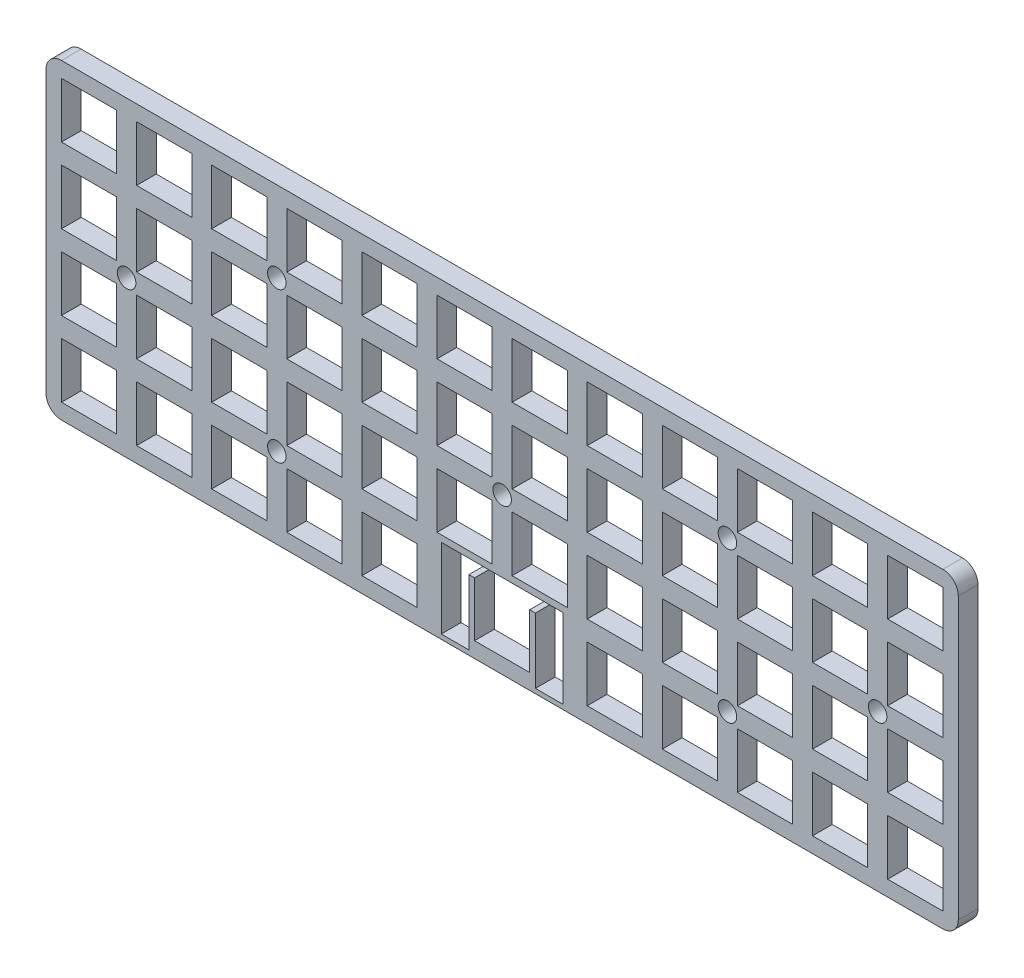
from build123d import *

# Parameters (mm, degrees)
CROQUIS3_W         = 14
CROQUIS3_H         = 14
CROQUIS3_R         = 2.35
MAINPLATE_DEPTH    = 5
F_5MM_CUTOUT_DEPTH = 255.927423495


with BuildPart() as part:
    # Croquis3 → MainPlate (new body)
    with BuildSketch(Plane.XY):
        with BuildLine():
            ThreePointArc((235.6, 8.125), (238.375394116, 9.274605884), (239.525, 12.05))
            Line((239.525, 12.05), (239.525, 83.2))
            ThreePointArc((239.525, 83.2), (238.375394116, 85.975394116), (235.6, 87.125))
            Line((235.6, 87.125), (12.05, 87.125))
            ThreePointArc((12.05, 87.125), (9.274605884, 85.975394116), (8.125, 83.2))
            Line((8.125, 83.2), (8.125, 12.05))
            ThreePointArc((8.125, 12.05), (9.274605884, 9.274605884), (12.05, 8.125))
            Line((12.05, 8.125), (235.6, 8.125))
        make_face()
        with Locations((123.825, 19.05)):
            Rectangle(CROQUIS3_W, CROQUIS3_H, mode=Mode.SUBTRACT)
        with Locations((19.05, 19.05)):
            Rectangle(CROQUIS3_W, CROQUIS3_H, mode=Mode.SUBTRACT)
        with Locations((38.1, 19.05)):
            Rectangle(CROQUIS3_W, CROQUIS3_H, mode=Mode.SUBTRACT)
        with Locations((57.15, 19.05)):
            Rectangle(CROQUIS3_W, CROQUIS3_H, mode=Mode.SUBTRACT)
        with Locations((76.2, 19.05)):
            Rectangle(CROQUIS3_W, CROQUIS3_H, mode=Mode.SUBTRACT)
        with Locations((95.25, 19.05)):
            Rectangle(CROQUIS3_W, CROQUIS3_H, mode=Mode.SUBTRACT)
        with Locations((19.05, 38.1)):
            Rectangle(CROQUIS3_W, CROQUIS3_H, mode=Mode.SUBTRACT)
        with Locations((28.575, 47.625)):
            Circle(CROQUIS3_R, mode=Mode.SUBTRACT)
        with Locations((38.1, 38.1)):
            Rectangle(CROQUIS3_W, CROQUIS3_H, mode=Mode.SUBTRACT)
        with Locations((57.15, 38.1)):
            Rectangle(CROQUIS3_W, CROQUIS3_H, mode=Mode.SUBTRACT)
        with Locations((66.675, 28.575)):
            Circle(CROQUIS3_R, mode=Mode.SUBTRACT)
        with Locations((76.2, 38.1)):
            Rectangle(CROQUIS3_W, CROQUIS3_H, mode=Mode.SUBTRACT)
        with Locations((95.25, 38.1)):
            Rectangle(CROQUIS3_W, CROQUIS3_H, mode=Mode.SUBTRACT)
        with Locations((114.3, 38.1)):
            Rectangle(CROQUIS3_W, CROQUIS3_H, mode=Mode.SUBTRACT)
        with Locations((228.6, 76.2)):
            Rectangle(CROQUIS3_W, CROQUIS3_H, mode=Mode.SUBTRACT)
        with Locations((152.4, 19.05)):
            Rectangle(CROQUIS3_W, CROQUIS3_H, mode=Mode.SUBTRACT)
        with Locations((171.45, 19.05)):
            Rectangle(CROQUIS3_W, CROQUIS3_H, mode=Mode.SUBTRACT)
        with Locations((190.5, 19.05)):
            Rectangle(CROQUIS3_W, CROQUIS3_H, mode=Mode.SUBTRACT)
        with Locations((209.55, 19.05)):
            Rectangle(CROQUIS3_W, CROQUIS3_H, mode=Mode.SUBTRACT)
        with Locations((228.6, 19.05)):
            Rectangle(CROQUIS3_W, CROQUIS3_H, mode=Mode.SUBTRACT)
        with Locations((180.975, 28.575)):
            Circle(CROQUIS3_R, mode=Mode.SUBTRACT)
        with Locations((133.35, 38.1)):
            Rectangle(CROQUIS3_W, CROQUIS3_H, mode=Mode.SUBTRACT)
        with Locations((152.4, 38.1)):
            Rectangle(CROQUIS3_W, CROQUIS3_H, mode=Mode.SUBTRACT)
        with Locations((123.825, 47.625)):
            Circle(CROQUIS3_R, mode=Mode.SUBTRACT)
        with Locations((171.45, 38.1)):
            Rectangle(CROQUIS3_W, CROQUIS3_H, mode=Mode.SUBTRACT)
        with Locations((190.5, 38.1)):
            Rectangle(CROQUIS3_W, CROQUIS3_H, mode=Mode.SUBTRACT)
        with Locations((209.55, 38.1)):
            Rectangle(CROQUIS3_W, CROQUIS3_H, mode=Mode.SUBTRACT)
        with Locations((228.6, 38.1)):
            Rectangle(CROQUIS3_W, CROQUIS3_H, mode=Mode.SUBTRACT)
        with Locations((219.075, 47.625)):
            Circle(CROQUIS3_R, mode=Mode.SUBTRACT)
        with Locations((19.05, 57.15)):
            Rectangle(CROQUIS3_W, CROQUIS3_H, mode=Mode.SUBTRACT)
        with Locations((38.1, 57.15)):
            Rectangle(CROQUIS3_W, CROQUIS3_H, mode=Mode.SUBTRACT)
        with Locations((57.15, 57.15)):
            Rectangle(CROQUIS3_W, CROQUIS3_H, mode=Mode.SUBTRACT)
        with Locations((76.2, 57.15)):
            Rectangle(CROQUIS3_W, CROQUIS3_H, mode=Mode.SUBTRACT)
        with Locations((95.25, 57.15)):
            Rectangle(CROQUIS3_W, CROQUIS3_H, mode=Mode.SUBTRACT)
        with Locations((114.3, 57.15)):
            Rectangle(CROQUIS3_W, CROQUIS3_H, mode=Mode.SUBTRACT)
        with Locations((66.675, 66.675)):
            Circle(CROQUIS3_R, mode=Mode.SUBTRACT)
        with Locations((19.05, 76.2)):
            Rectangle(CROQUIS3_W, CROQUIS3_H, mode=Mode.SUBTRACT)
        with Locations((38.1, 76.2)):
            Rectangle(CROQUIS3_W, CROQUIS3_H, mode=Mode.SUBTRACT)
        with Locations((57.15, 76.2)):
            Rectangle(CROQUIS3_W, CROQUIS3_H, mode=Mode.SUBTRACT)
        with Locations((76.2, 76.2)):
            Rectangle(CROQUIS3_W, CROQUIS3_H, mode=Mode.SUBTRACT)
        with Locations((95.25, 76.2)):
            Rectangle(CROQUIS3_W, CROQUIS3_H, mode=Mode.SUBTRACT)
        with Locations((114.3, 76.2)):
            Rectangle(CROQUIS3_W, CROQUIS3_H, mode=Mode.SUBTRACT)
        with Locations((133.35, 57.15)):
            Rectangle(CROQUIS3_W, CROQUIS3_H, mode=Mode.SUBTRACT)
        with Locations((152.4, 57.15)):
            Rectangle(CROQUIS3_W, CROQUIS3_H, mode=Mode.SUBTRACT)
        with Locations((171.45, 57.15)):
            Rectangle(CROQUIS3_W, CROQUIS3_H, mode=Mode.SUBTRACT)
        with Locations((180.975, 66.675)):
            Circle(CROQUIS3_R, mode=Mode.SUBTRACT)
        with Locations((190.5, 57.15)):
            Rectangle(CROQUIS3_W, CROQUIS3_H, mode=Mode.SUBTRACT)
        with Locations((209.55, 57.15)):
            Rectangle(CROQUIS3_W, CROQUIS3_H, mode=Mode.SUBTRACT)
        with Locations((228.6, 57.15)):
            Rectangle(CROQUIS3_W, CROQUIS3_H, mode=Mode.SUBTRACT)
        with Locations((133.35, 76.2)):
            Rectangle(CROQUIS3_W, CROQUIS3_H, mode=Mode.SUBTRACT)
        with Locations((152.4, 76.2)):
            Rectangle(CROQUIS3_W, CROQUIS3_H, mode=Mode.SUBTRACT)
        with Locations((171.45, 76.2)):
            Rectangle(CROQUIS3_W, CROQUIS3_H, mode=Mode.SUBTRACT)
        with Locations((190.5, 76.2)):
            Rectangle(CROQUIS3_W, CROQUIS3_H, mode=Mode.SUBTRACT)
        with Locations((209.55, 76.2)):
            Rectangle(CROQUIS3_W, CROQUIS3_H, mode=Mode.SUBTRACT)
    extrude(amount=MAINPLATE_DEPTH)

    # Croquis7 → 5mm cutout (cut, through all)
    with BuildSketch(Plane.XY.offset(5)):
        Polygon((108.387, 9.3), (115.387, 9.3), (115.387, 25.85), (132.263, 25.85), (132.263, 9.3), (139.263, 9.3), (139.263, 29.45), (108.387, 29.45), align=None)
    extrude(amount=-F_5MM_CUTOUT_DEPTH, mode=Mode.SUBTRACT)


solid = part.part
